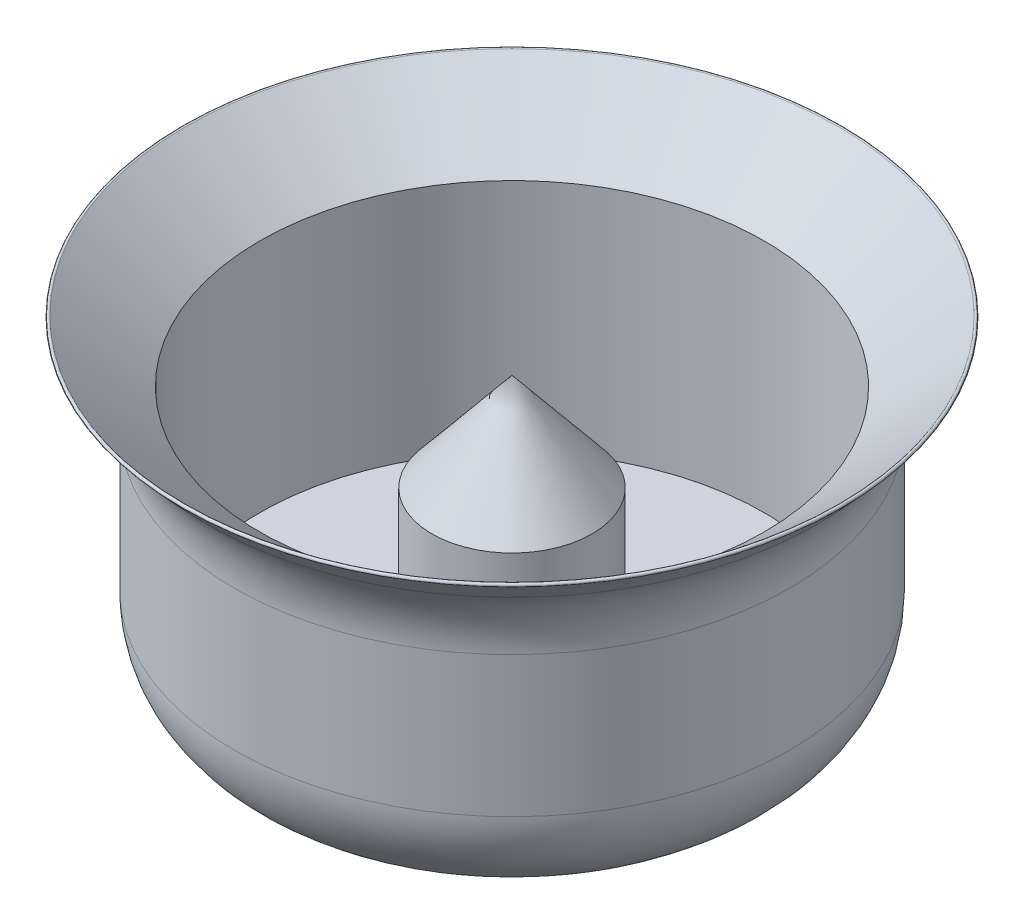
from build123d import *

# Parameters (mm, degrees)
FILLET1_R = 6
FILLET2_R = 0.1


with BuildPart() as part:
    # Sketch1 → Revolve1 (revolve)
    with BuildSketch(Plane.XY):
        Polygon((0, 17.074400117), (0, 0), (16.5, 0), (16.5, 16.712830718), (20.61017272, 21.117501694), (15, 16.5), (15, 2.5), (4.765, 2.5), (4.765, 11.285019889), align=None)
    revolve(axis=Axis((0, 0, 0), (0, 1, 0)))

    # Fillet1
    fillet1_edges = [part.edges().sort_by_distance(p)[0] for p in [
        (-16.5, 16.712830718, 0),
        (-16.5, 0, 0),
    ]]
    fillet(fillet1_edges, radius=FILLET1_R)

    # Fillet2
    fillet2_edges = [part.edges().sort_by_distance(p)[0] for p in [
        (-20.61017272, 21.117501694, 0),
    ]]
    fillet(fillet2_edges, radius=FILLET2_R)


solid = part.part
